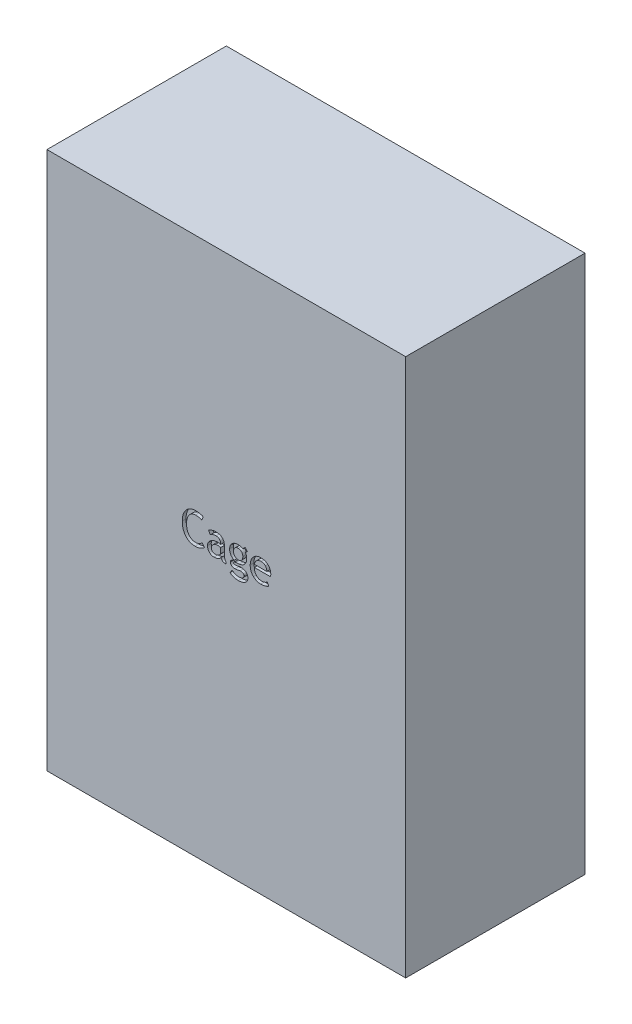
from build123d import *

# Parameters (mm, degrees)
SKETCH1_W           = 1219.2
SKETCH1_H           = 609.6
BOSS_EXTRUDE1_DEPTH = 1828.8
CUT_EXTRUDE1_DEPTH  = 12.7


with BuildPart() as part:
    # Sketch1 → Boss-Extrude1 (new body)
    with BuildSketch(Plane(origin=(0, 0, 0), x_dir=(1, 0, 0), z_dir=(0, 1, 0))):
        Rectangle(SKETCH1_W, SKETCH1_H)
    extrude(amount=BOSS_EXTRUDE1_DEPTH)

    # Sketch2 → Cut-Extrude1 (cut)
    # profile 1 of 4: a face of its own
    with BuildSketch(Plane.XY.offset(304.8)):
        with BuildLine():
            Line((-78.509090909, 1013.361038961), (-83.292207792, 1001.465097403))
            add(Edge.make_bspline(
                [(-83.292207792, 1001.465097403), (-83.897637932, 1001.787844701), (-85.160333316, 1002.460971949), (-87.266288882, 1003.239996583), (-89.588847372, 1003.948870313), (-92.170312266, 1004.495262358), (-94.986263745, 1004.921183646), (-98.055244325, 1005.226463322), (-101.364045416, 1005.411270162), (-103.654564873, 1005.432960205), (-104.836850649, 1005.444155844)],
                knots=[0, 0, 0, 0, 0.743181025, 1.549990972, 2.429353565, 3.375047818, 4.407890241, 5.516430014, 6.718068314, 8, 8, 8, 8], degree=3))
            add(Edge.make_bspline(
                [(-104.836850649, 1005.444155844), (-105.959231968, 1005.408591056), (-108.155393824, 1005.339001488), (-111.369165746, 1004.789030084), (-114.409127347, 1003.883520687), (-117.286830445, 1002.613964125), (-119.987107083, 1000.976325728), (-122.491787515, 998.942015589), (-124.852116922, 996.587966232), (-127.004966569, 993.884129839), (-128.936509189, 990.896128445), (-130.616912327, 987.673661074), (-132.083767804, 984.257898529), (-133.219834335, 980.610822602), (-134.128411469, 976.766377857), (-134.786642105, 972.709376628), (-135.183028824, 968.444835501), (-135.225239195, 965.530732972), (-135.246753247, 964.045454545)],
                knots=[0, 0, 0, 0, 0.93729464, 1.834003029, 2.715004989, 3.581291106, 4.454701967, 5.345101795, 6.270753011, 7.234680245, 8.226835646, 9.238713877, 10.267793776, 11.32822161, 12.42561983, 13.565859063, 14.75935147, 16, 16, 16, 16], degree=3))
            add(Edge.make_bspline(
                [(-135.246753247, 964.045454545), (-135.227840473, 962.628597541), (-135.190755949, 959.850397582), (-134.758646115, 955.794357834), (-134.1135294, 951.938987029), (-133.182236092, 948.290658729), (-131.989470305, 944.84918985), (-130.542779701, 941.597523866), (-128.807426387, 938.571839742), (-126.834802483, 935.761417921), (-124.636271722, 933.241680956), (-122.285175434, 931.00723765), (-119.748870134, 929.146140356), (-117.079293629, 927.601700176), (-114.243227579, 926.417774859), (-111.253289233, 925.575630887), (-108.106576538, 925.040995632), (-105.952330246, 924.984537923), (-104.857467532, 924.955844156)],
                knots=[0, 0, 0, 0, 1.226633351, 2.40520583, 3.528543623, 4.609795719, 5.6620223, 6.679728427, 7.687447284, 8.678273178, 9.648614578, 10.579204689, 11.481557175, 12.366726839, 13.244420817, 14.135573581, 15.052433801, 16, 16, 16, 16], degree=3))
            add(Edge.make_bspline(
                [(-104.857467532, 924.955844156), (-103.673774006, 924.986387262), (-101.364255298, 925.045980286), (-98.00028907, 925.543335171), (-94.857102861, 926.393079276), (-91.90638197, 927.549622507), (-89.183501521, 929.064566567), (-86.656438045, 930.890149139), (-84.366853258, 933.080326281), (-83.039835854, 934.746270601), (-82.364448052, 935.594155844)],
                knots=[0, 0, 0, 0, 1.097389961, 2.141130781, 3.144492999, 4.111406536, 5.072758937, 6.026305338, 6.995484689, 8, 8, 8, 8], degree=3))
            Line((-82.364448052, 935.594155844), (-74.550649351, 924.955844156))
            add(Edge.make_bspline(
                [(-74.550649351, 924.955844156), (-75.589438442, 924.004424936), (-77.6542195, 922.113307289), (-81.089838406, 919.703603677), (-84.734125957, 917.647026867), (-88.606881078, 915.977373223), (-92.694492639, 914.670670476), (-97.003444908, 913.751173802), (-101.529746673, 913.181939483), (-104.622105155, 913.114750277), (-106.197564935, 913.080519481)],
                knots=[0, 0, 0, 0, 0.973901451, 1.935805146, 2.896097029, 3.865214868, 4.848786196, 5.860812937, 6.910151201, 8, 8, 8, 8], degree=3))
            add(Edge.make_bspline(
                [(-106.197564935, 913.080519481), (-107.842705267, 913.12113508), (-111.058335529, 913.200523292), (-115.740074273, 913.906525015), (-120.168684223, 914.99804562), (-124.312700761, 916.606183367), (-128.202482014, 918.63199133), (-131.813968595, 921.128297435), (-135.151832207, 924.080078341), (-138.194167971, 927.461013115), (-140.903460135, 931.218480418), (-143.289189377, 935.27252547), (-145.286899371, 939.629841108), (-146.938214318, 944.257800982), (-148.219421174, 949.176598168), (-149.112615728, 954.376781264), (-149.656426696, 959.869256336), (-149.72558297, 963.624960745), (-149.761038961, 965.550487013)],
                knots=[0, 0, 0, 0, 1.026774208, 2.006957187, 2.949983192, 3.86971466, 4.775767412, 5.68286642, 6.60415852, 7.552200267, 8.517071902, 9.492319463, 10.485049057, 11.505832625, 12.557165439, 13.655005808, 14.797736077, 16, 16, 16, 16], degree=3))
            add(Edge.make_bspline(
                [(-149.761038961, 965.550487013), (-149.730538429, 967.414665576), (-149.670610156, 971.077454233), (-149.047958722, 976.438401442), (-148.092110744, 981.564443511), (-146.726045114, 986.44866179), (-144.981291766, 991.098992625), (-142.817711068, 995.498316201), (-140.277580379, 999.658025046), (-137.360483703, 1003.534764604), (-134.150832351, 1007.071095433), (-130.672166478, 1010.16881065), (-126.953673423, 1012.782581429), (-123.021949395, 1014.950477311), (-118.841742933, 1016.606949341), (-114.4332592, 1017.774348781), (-109.803728905, 1018.525321982), (-106.633464127, 1018.60067051), (-105.022402597, 1018.638961039)],
                knots=[0, 0, 0, 0, 1.151460384, 2.262420628, 3.330148846, 4.370797394, 5.392188392, 6.394959303, 7.395659951, 8.399554213, 9.388499259, 10.342092793, 11.271669333, 12.191485065, 13.110172784, 14.042422641, 15.005200576, 16, 16, 16, 16], degree=3))
            add(Edge.make_bspline(
                [(-105.022402597, 1018.638961039), (-103.647564038, 1018.623928162), (-100.971147224, 1018.594663458), (-97.07679146, 1018.345618551), (-93.408923578, 1017.936278384), (-89.97226487, 1017.367946539), (-86.762015835, 1016.6274015), (-83.790547287, 1015.725470257), (-81.040475021, 1014.66002116), (-79.340818975, 1013.787841021), (-78.509090909, 1013.361038961)],
                knots=[0, 0, 0, 0, 1.208331266, 2.352274815, 3.428237893, 4.451073276, 5.41226407, 6.321787922, 7.178765556, 8, 8, 8, 8], degree=3))
        make_face()
    # profile 2 of 4: a face of its own
    with BuildSketch(Plane.XY.offset(304.8)):
        with BuildLine():
            add(Edge.make_bspline(
                [(-17.874837662, 923.636363636), (-18.56039554, 922.790969175), (-19.921334271, 921.112730031), (-22.349532136, 918.970272111), (-25.012405503, 917.124521622), (-27.9607767, 915.64720517), (-31.164088668, 914.484420221), (-34.630432079, 913.670096435), (-38.360127835, 913.167290863), (-40.936595234, 913.110032664), (-42.26461039, 913.080519481)],
                knots=[0, 0, 0, 0, 0.944960127, 1.875892434, 2.804059133, 3.755402226, 4.734562172, 5.760675535, 6.845761903, 8, 8, 8, 8], degree=3))
            add(Edge.make_bspline(
                [(-42.26461039, 913.080519481), (-42.987527783, 913.098931277), (-44.412654183, 913.135227454), (-46.508661016, 913.465686403), (-48.547397384, 913.945246686), (-50.501367903, 914.681848663), (-52.394801298, 915.584543132), (-54.190350106, 916.718025602), (-55.940236983, 918.013506596), (-57.564696019, 919.532738767), (-59.064980714, 921.192379574), (-60.394188296, 922.96718545), (-61.507168938, 924.850090656), (-62.429853605, 926.828460625), (-63.126201247, 928.912177049), (-63.613589759, 931.089146984), (-63.941165409, 933.357676716), (-63.976658239, 934.905739025), (-63.994805195, 935.69724026)],
                knots=[0, 0, 0, 0, 0.993455545, 1.95845298, 2.911997968, 3.868815737, 4.82409202, 5.79181603, 6.784147119, 7.814064514, 8.844588789, 9.85771863, 10.857760396, 11.847207058, 12.854368548, 13.872291747, 14.912134415, 16, 16, 16, 16], degree=3))
            add(Edge.make_bspline(
                [(-63.994805195, 935.69724026), (-63.960273312, 936.647205575), (-63.892311443, 938.51682322), (-63.438947477, 941.263477775), (-62.63616001, 943.887511837), (-61.553077146, 946.408470584), (-60.1181457, 948.802853971), (-58.406957698, 951.097720435), (-56.369144219, 953.269809881), (-54.04050381, 955.294518554), (-51.493312879, 957.164221485), (-48.720874409, 958.773960211), (-45.796543293, 960.166893377), (-42.68072277, 961.266845909), (-39.419042935, 962.168383511), (-35.97408492, 962.773318152), (-32.36339107, 963.153730633), (-29.895471268, 963.198133891), (-28.636850649, 963.220779221)],
                knots=[0, 0, 0, 0, 0.914144162, 1.799118376, 2.669442492, 3.549088249, 4.432603435, 5.349184236, 6.299014847, 7.292526244, 8.315019686, 9.334664862, 10.373010545, 11.427301971, 12.510180587, 13.625743326, 14.789146875, 16, 16, 16, 16], degree=3))
            add(Edge.make_bspline(
                [(-28.636850649, 963.220779221), (-27.914623143, 963.203730344), (-26.418172038, 963.168405173), (-24.111801989, 962.905277427), (-21.661566463, 962.492013098), (-19.996453512, 962.103097433), (-19.132467532, 961.901298701)],
                knots=[0, 0, 0, 0, 0.901025355, 1.866919186, 2.893197055, 4, 4, 4, 4], degree=3))
            add(Edge.make_bspline(
                [(-19.132467532, 961.901298701), (-19.144162144, 962.595713502), (-19.166785804, 963.939084646), (-19.345770242, 965.892015391), (-19.684690213, 967.700484817), (-20.102636954, 969.39221497), (-20.688419757, 970.93218503), (-21.364767641, 972.359177683), (-22.191312952, 973.639867833), (-23.152547968, 974.782812972), (-24.226088538, 975.811115889), (-25.456518438, 976.663864963), (-26.784962629, 977.428650826), (-28.256385404, 978.007459825), (-29.838009445, 978.49829581), (-31.554842922, 978.809821101), (-33.393698664, 979.028364356), (-34.663135709, 979.045647182), (-35.316720779, 979.054545455)],
                knots=[0, 0, 0, 0, 1.232010569, 2.38337006, 3.473922505, 4.494186629, 5.47029199, 6.391873334, 7.29149648, 8.165725792, 9.03688882, 9.919916482, 10.815232808, 11.75034576, 12.71849901, 13.749128771, 14.841111628, 16, 16, 16, 16], degree=3))
            add(Edge.make_bspline(
                [(-35.316720779, 979.054545455), (-36.320911028, 979.035775608), (-38.279298624, 978.999170358), (-41.127002907, 978.685730327), (-43.798359564, 978.177889311), (-46.290592679, 977.453196163), (-48.609282838, 976.530108785), (-50.74556414, 975.389802365), (-52.710336891, 974.047096738), (-53.869867552, 972.986856482), (-54.449188312, 972.457142857)],
                knots=[0, 0, 0, 0, 1.160376748, 2.26298496, 3.306713365, 4.299604534, 5.258357027, 6.185834306, 7.093612716, 8, 8, 8, 8], degree=3))
            Line((-54.449188312, 972.457142857), (-60.036363636, 983.012987013))
            add(Edge.make_bspline(
                [(-60.036363636, 983.012987013), (-59.36040424, 983.551241085), (-57.943307692, 984.679649081), (-55.486699328, 986.119982014), (-52.692102003, 987.458160886), (-49.610303953, 988.649085549), (-46.383553402, 989.632049855), (-43.158142241, 990.393995848), (-39.995650379, 990.840672792), (-37.908878097, 990.900483766), (-36.883603896, 990.92987013)],
                knots=[0, 0, 0, 0, 0.83233406, 1.744923925, 2.737828223, 3.818310257, 4.927193929, 5.988133053, 7.011528333, 8, 8, 8, 8], degree=3))
            add(Edge.make_bspline(
                [(-36.883603896, 990.92987013), (-35.577064157, 990.906088641), (-33.048387729, 990.860061957), (-29.396080319, 990.509067041), (-26.017925658, 989.936718743), (-22.911064853, 989.14894727), (-20.087430806, 988.089788386), (-17.534931321, 986.81735598), (-15.255227369, 985.301277266), (-13.256969615, 983.526921781), (-11.502082679, 981.508047962), (-10.012713288, 979.201680846), (-8.734704833, 976.645660354), (-7.703944751, 973.807307568), (-6.907072862, 970.699483354), (-6.335505181, 967.320771617), (-6.013447257, 963.666844882), (-5.963530391, 961.145979905), (-5.937662338, 959.83961039)],
                knots=[0, 0, 0, 0, 1.2352911, 2.390781845, 3.465517746, 4.472669273, 5.416533714, 6.311624893, 7.164115709, 7.997342812, 8.831177852, 9.685499483, 10.586398193, 11.528000591, 12.535152118, 13.616293066, 14.7647089, 16, 16, 16, 16], degree=3))
            Line((-5.937662338, 959.83961039), (-5.937662338, 932.872727273))
            add(Edge.make_bspline(
                [(-5.937662338, 932.872727273), (-5.923269679, 932.08170691), (-5.89565835, 930.564188559), (-5.647711502, 928.390529498), (-5.243515052, 926.419937146), (-4.669820212, 924.652497442), (-3.928563621, 923.08676798), (-3.013334609, 921.730413377), (-1.936407496, 920.565442541), (-1.083994661, 919.972857556), (-0.65974026, 919.677922078)],
                knots=[0, 0, 0, 0, 1.279077697, 2.453822896, 3.53296146, 4.527738333, 5.452481132, 6.324974507, 7.166323045, 8, 8, 8, 8], degree=3))
            Line((-0.65974026, 919.677922078), (-0.65974026, 913.080519481))
            add(Edge.make_bspline(
                [(-0.65974026, 913.080519481), (-1.878191488, 913.099511218), (-4.160882408, 913.13509103), (-7.342842502, 913.616572081), (-10.059231404, 914.344885824), (-12.335550848, 915.431701533), (-14.203924174, 916.92115413), (-15.741984859, 918.792931156), (-16.989889211, 921.065802136), (-17.570730521, 922.753005845), (-17.874837662, 923.636363636)],
                knots=[0, 0, 0, 0, 1.322927942, 2.4784214, 3.487862418, 4.369631662, 5.198919122, 6.063344162, 6.986038252, 8, 8, 8, 8], degree=3))
        make_face()
        with BuildLine():
            add(Edge.make_bspline(
                [(-19.132467532, 952.664935065), (-20.100282372, 952.863975843), (-21.880497696, 953.230094885), (-24.321676567, 953.637315236), (-26.294036016, 953.917594636), (-27.454201967, 953.964226438), (-27.956493506, 953.984415584)],
                knots=[0, 0, 0, 0, 1.327096202, 2.441083662, 3.325070274, 4, 4, 4, 4], degree=3))
            add(Edge.make_bspline(
                [(-27.956493506, 953.984415584), (-28.781662771, 953.968594706), (-30.394636322, 953.937669343), (-32.755435175, 953.695794724), (-34.990150284, 953.24788), (-37.124205923, 952.689153687), (-39.128730136, 951.916022334), (-41.02595354, 950.987168638), (-42.790876891, 949.867452743), (-44.441160751, 948.620702948), (-45.911833815, 947.239923583), (-47.223518955, 945.802348598), (-48.320814372, 944.283010247), (-49.240178608, 942.71450051), (-49.941708215, 941.078893076), (-50.447194598, 939.385226983), (-50.736423373, 937.62457312), (-50.778646549, 936.426726419), (-50.8, 935.820941558)],
                knots=[0, 0, 0, 0, 1.220287638, 2.385318708, 3.503525747, 4.58834872, 5.643485871, 6.675260618, 7.707335663, 8.72980793, 9.729394515, 10.686538231, 11.60338903, 12.495920083, 13.370033194, 14.228646617, 15.104176635, 16, 16, 16, 16], degree=3))
            add(Edge.make_bspline(
                [(-50.8, 935.820941558), (-50.769935723, 934.861000685), (-50.713078932, 933.045585057), (-50.038132162, 930.519705818), (-48.957849825, 928.360908326), (-47.400869554, 926.59826576), (-45.404420371, 925.230451172), (-42.969191126, 924.298407439), (-40.126981589, 923.718332195), (-38.089413672, 923.664795711), (-37.007305195, 923.636363636)],
                knots=[0, 0, 0, 0, 1.090937083, 2.063152309, 2.952441297, 3.817735852, 4.712383707, 5.68197955, 6.768949218, 8, 8, 8, 8], degree=3))
            add(Edge.make_bspline(
                [(-37.007305195, 923.636363636), (-36.173194063, 923.66722146), (-34.517545622, 923.728471941), (-32.076391847, 924.248664269), (-29.711187533, 925.074696447), (-27.426056125, 926.244750781), (-25.225880514, 927.750764384), (-23.099433663, 929.583496931), (-21.025144553, 931.729742072), (-19.77648749, 933.354306211), (-19.132467532, 934.192207792)],
                knots=[0, 0, 0, 0, 0.926994493, 1.840014991, 2.763567446, 3.707150477, 4.686710869, 5.722325487, 6.825243626, 8, 8, 8, 8], degree=3))
            Line((-19.132467532, 934.192207792), (-19.132467532, 952.664935065))
        make_face(mode=Mode.SUBTRACT)
    # profile 3 of 4: a face of its own
    with BuildSketch(Plane.XY.offset(304.8)):
        with BuildLine():
            Line((12.535064935, 894.381006494), (19.64788961, 905.163636364))
            add(Edge.make_bspline(
                [(19.64788961, 905.163636364), (20.589530683, 904.534543848), (22.422283191, 903.310116707), (25.21562724, 901.694766929), (27.951810819, 900.336746366), (30.62545367, 899.206076983), (33.251340276, 898.332394407), (35.824183633, 897.716683422), (38.341980223, 897.320023834), (40.002234362, 897.27096139), (40.821428571, 897.246753247)],
                knots=[0, 0, 0, 0, 1.184445197, 2.305331583, 3.372746086, 4.378123596, 5.339779337, 6.263942773, 7.143403414, 8, 8, 8, 8], degree=3))
            add(Edge.make_bspline(
                [(40.821428571, 897.246753247), (42.233154107, 897.272987188), (44.912806167, 897.322782869), (48.686465727, 897.942313567), (52.020728496, 898.846845406), (54.428966644, 900.020182718), (56.079804438, 901.098036081), (57.124059564, 901.955487952), (58.015277302, 902.845404459), (58.777238416, 903.768118579), (59.335911808, 904.771532575), (59.726869421, 905.815486481), (59.991302191, 906.896207642), (60.021270563, 907.636121097), (60.036363636, 908.008766234)],
                knots=[0, 0, 0, 0, 2.093703985, 3.974142319, 5.663006758, 7.205436512, 7.927067427, 8.58682346, 9.207301964, 9.795302503, 10.357228975, 10.90298962, 11.447508922, 12, 12, 12, 12], degree=3))
            add(Edge.make_bspline(
                [(60.036363636, 908.008766234), (60.002091335, 908.721988104), (59.936714211, 910.082515186), (59.294906585, 911.975174927), (58.251656608, 913.591488868), (56.762554814, 914.890166233), (54.856766412, 915.852023282), (52.584234228, 916.575472733), (49.891934454, 916.961561154), (47.969734253, 917.012040745), (46.944642857, 917.038961039)],
                knots=[0, 0, 0, 0, 0.945778284, 1.804146819, 2.622921598, 3.4775355, 4.397390983, 5.44367589, 6.636736251, 8, 8, 8, 8], degree=3))
            add(Edge.make_bspline(
                [(46.944642857, 917.038961039), (46.497316128, 917.018261586), (45.446732387, 916.969647212), (43.652843063, 916.692048461), (41.404815311, 916.2806759), (38.843571793, 915.713200662), (36.213611226, 915.142402771), (33.764785446, 914.732204773), (31.639225779, 914.459837718), (30.328067869, 914.418754037), (29.729545455, 914.4)],
                knots=[0, 0, 0, 0, 0.61576396, 1.446172479, 2.49401736, 3.76065346, 5.055042787, 6.196016743, 7.176510772, 8, 8, 8, 8], degree=3))
            add(Edge.make_bspline(
                [(29.729545455, 914.4), (29.089773659, 914.402368432), (27.849119622, 914.406961328), (26.050114695, 914.600865964), (24.361674696, 914.793289925), (22.810465861, 915.163673448), (21.371614263, 915.577894573), (20.074336869, 916.145322707), (18.891643994, 916.78219334), (17.817619378, 917.510468405), (16.876346174, 918.350358572), (16.057962927, 919.292226402), (15.37253981, 920.332512042), (14.818849485, 921.471115227), (14.380424032, 922.701356055), (14.075603762, 924.029573455), (13.887038707, 925.458969984), (13.865599239, 926.446519793), (13.854545455, 926.955681818)],
                knots=[0, 0, 0, 0, 1.326766046, 2.572882493, 3.752925194, 4.84978635, 5.878503952, 6.856118156, 7.781566206, 8.663799574, 9.542683042, 10.392020665, 11.246492449, 12.120385188, 13.013618254, 13.951187018, 14.943670733, 16, 16, 16, 16], degree=3))
            add(Edge.make_bspline(
                [(13.854545455, 926.955681818), (13.894834413, 927.588582718), (13.976341468, 928.868980386), (14.770985528, 930.702088078), (15.96757431, 932.444915613), (17.641507828, 934.022017945), (19.626837236, 935.468495961), (21.875094237, 936.724754053), (24.357070574, 937.743331368), (26.10890834, 938.230472604), (27.008116883, 938.480519481)],
                knots=[0, 0, 0, 0, 0.808139807, 1.634916817, 2.52262721, 3.507708434, 4.567521049, 5.668769468, 6.803392385, 8, 8, 8, 8], degree=3))
            add(Edge.make_bspline(
                [(27.008116883, 938.480519481), (25.750464458, 939.112030635), (23.312996134, 940.33596851), (20.077315514, 942.712575429), (17.318724617, 945.397805845), (15.088489223, 948.459604279), (13.334394319, 951.835053011), (12.099283216, 955.556658432), (11.345512767, 959.609900592), (11.259803727, 962.427073593), (11.215584416, 963.880519481)],
                knots=[0, 0, 0, 0, 1.060453993, 2.055276136, 3.016126786, 3.954902892, 4.901312321, 5.875507213, 6.903924146, 8, 8, 8, 8], degree=3))
            add(Edge.make_bspline(
                [(11.215584416, 963.880519481), (11.236060269, 964.830440835), (11.276158187, 966.690674265), (11.688866049, 969.416951692), (12.320489914, 972.022310975), (13.212054658, 974.510281291), (14.354901306, 976.882957424), (15.757435761, 979.130334076), (17.42976253, 981.252771724), (19.331400015, 983.231154403), (21.416414767, 985.032869913), (23.641299355, 986.609359451), (25.974770645, 987.972569211), (28.458679325, 989.024726579), (31.041302701, 989.88614087), (33.745430235, 990.508407442), (36.579050728, 990.854075081), (38.504566959, 990.904361261), (39.481331169, 990.92987013)],
                knots=[0, 0, 0, 0, 1.042956208, 2.042423822, 3.022160224, 3.984636886, 4.940337134, 5.910365988, 6.889141792, 7.903781168, 8.920945854, 9.911906719, 10.896200396, 11.883674538, 12.86979101, 13.884514665, 14.926869414, 16, 16, 16, 16], degree=3))
            add(Edge.make_bspline(
                [(39.481331169, 990.92987013), (40.375334338, 990.92269714), (42.111504269, 990.908767068), (44.636910085, 990.666294524), (47.011944634, 990.320302392), (49.250896586, 989.858445763), (51.334731226, 989.220765737), (53.259285146, 988.427118183), (55.05421625, 987.533203927), (56.140160561, 986.798023509), (56.675811688, 986.43538961)],
                knots=[0, 0, 0, 0, 1.187598972, 2.306338158, 3.36804058, 4.376517905, 5.341416913, 6.258948422, 7.141211726, 8, 8, 8, 8], degree=3))
            Line((56.675811688, 986.43538961), (63.273214286, 994.888311688))
            Line((63.273214286, 994.888311688), (71.911688312, 986.456006494))
            Line((71.911688312, 986.456006494), (64.180357143, 980.270941558))
            add(Edge.make_bspline(
                [(64.180357143, 980.270941558), (64.591554829, 979.708705901), (65.417305342, 978.579647059), (66.43582905, 976.722141608), (67.33821191, 974.767126738), (68.027154842, 972.665747141), (68.583001299, 970.454137899), (69.005757605, 968.114034651), (69.219575691, 965.643874755), (69.254792056, 963.956456898), (69.272727273, 963.097077922)],
                knots=[0, 0, 0, 0, 0.915457603, 1.838384824, 2.781158444, 3.744642584, 4.742344353, 5.779846864, 6.869306188, 8, 8, 8, 8], degree=3))
            add(Edge.make_bspline(
                [(69.272727273, 963.097077922), (69.255059265, 962.175236047), (69.220394842, 960.366593175), (68.884928653, 957.715207937), (68.319829478, 955.186885943), (67.569158207, 952.752852081), (66.541638109, 950.454255731), (65.349420155, 948.235461636), (63.893948221, 946.162169899), (62.253711288, 944.20019416), (60.414992285, 942.424065313), (58.461486979, 940.78587174), (56.320061156, 939.426650344), (54.0807959, 938.202009194), (51.684568034, 937.221765406), (49.150508135, 936.442666671), (46.486673559, 935.823736316), (44.645400613, 935.616974862), (43.707792208, 935.511688312)],
                knots=[0, 0, 0, 0, 1.063977902, 2.087512078, 3.078957627, 4.052622123, 5.022626396, 5.981369196, 6.956422911, 7.941881261, 8.92941376, 9.904725716, 10.879682573, 11.852376671, 12.84847863, 13.862371767, 14.911482296, 16, 16, 16, 16], degree=3))
            Line((43.707792208, 935.511688312), (32.73961039, 934.542694805))
            add(Edge.make_bspline(
                [(32.73961039, 934.542694805), (32.394753551, 934.486776553), (31.634936565, 934.363572855), (30.43006876, 934.023098125), (29.064090773, 933.537796867), (27.617001306, 932.963108288), (26.254048091, 932.291154886), (25.208321949, 931.43302165), (24.541278737, 930.425453145), (24.453126913, 929.685408111), (24.41038961, 929.326623377)],
                knots=[0, 0, 0, 0, 0.798572579, 1.759480869, 2.858113958, 4.113260822, 5.322692235, 6.314972957, 7.183074066, 8, 8, 8, 8], degree=3))
            add(Edge.make_bspline(
                [(24.41038961, 929.326623377), (24.426740506, 929.081573729), (24.458815488, 928.600868357), (24.823625524, 927.94947085), (25.39237686, 927.423393218), (26.153457139, 926.989124287), (27.128628619, 926.671218038), (28.303561729, 926.429177667), (29.698800071, 926.289985064), (30.6982239, 926.28044466), (31.234577922, 926.275324675)],
                knots=[0, 0, 0, 0, 0.708089236, 1.389034028, 2.111423877, 2.946128647, 3.921545664, 5.088153572, 6.437319086, 8, 8, 8, 8], degree=3))
            add(Edge.make_bspline(
                [(31.234577922, 926.275324675), (31.805573195, 926.294842882), (33.089118715, 926.338718038), (35.213924164, 926.613310176), (37.751118637, 927.025156018), (40.5597288, 927.597673245), (43.370007106, 928.161457395), (45.920078649, 928.57861199), (48.059015432, 928.850868925), (49.356237662, 928.894742182), (49.934090909, 928.914285714)],
                knots=[0, 0, 0, 0, 0.724765678, 1.629207425, 2.716102254, 3.987031745, 5.266521789, 6.353416617, 7.266522319, 8, 8, 8, 8], degree=3))
            add(Edge.make_bspline(
                [(49.934090909, 928.914285714), (50.827966589, 928.898789226), (52.564359663, 928.868686612), (55.096279318, 928.626075518), (57.463092238, 928.184640827), (59.69312632, 927.622951834), (61.754688898, 926.845643283), (63.693839371, 925.947439262), (65.469226983, 924.850494754), (67.083245949, 923.587608374), (68.527117525, 922.18427306), (69.804526781, 920.654486144), (70.847324103, 918.971700825), (71.728260216, 917.179841934), (72.413760141, 915.251321909), (72.872447553, 913.187026139), (73.173073944, 911.000087761), (73.211441247, 909.501101439), (73.231168831, 908.730357143)],
                knots=[0, 0, 0, 0, 1.228476805, 2.386370572, 3.490547913, 4.535231113, 5.542346557, 6.514116706, 7.468284222, 8.403564812, 9.325345948, 10.23116451, 11.135257843, 12.039252491, 12.971332102, 13.940528263, 14.941066992, 16, 16, 16, 16], degree=3))
            add(Edge.make_bspline(
                [(73.231168831, 908.730357143), (73.20468531, 907.876234592), (73.152644431, 906.197859266), (72.704675991, 903.746099053), (71.989148297, 901.420898365), (70.956409825, 899.230263171), (69.659156925, 897.157507104), (68.039734976, 895.229205018), (66.163416042, 893.405826428), (63.99591698, 891.758489849), (61.63507434, 890.251977117), (59.081803614, 888.955237327), (56.386513782, 887.844872543), (53.534200746, 886.927166271), (50.532616893, 886.236000699), (47.376383665, 885.747647471), (44.071792294, 885.425821549), (41.811819731, 885.389828611), (40.656493506, 885.371428571)],
                knots=[0, 0, 0, 0, 0.916604991, 1.801155113, 2.667160974, 3.522312259, 4.394584979, 5.285668894, 6.21993082, 7.198638882, 8.203922042, 9.223836096, 10.269564828, 11.331522603, 12.437867392, 13.573559167, 14.759573115, 16, 16, 16, 16], degree=3))
            add(Edge.make_bspline(
                [(40.656493506, 885.371428571), (39.431474853, 885.403373466), (36.944339637, 885.468230659), (33.1702821, 886.003523426), (29.290492413, 886.789499269), (25.415941099, 887.946281251), (21.672740814, 889.285369259), (18.265953168, 890.837042949), (15.198399192, 892.462125842), (13.402098535, 893.756325609), (12.535064935, 894.381006494)],
                knots=[0, 0, 0, 0, 0.980661874, 1.991021668, 3.047761857, 4.148517958, 5.226261617, 6.228811154, 7.145087302, 8, 8, 8, 8], degree=3))
        make_face()
        with BuildLine():
            add(Edge.make_bspline(
                [(40.574025974, 980.374025974), (39.989067308, 980.357765011), (38.848993588, 980.326072692), (37.179024374, 980.090309628), (35.590141101, 979.723223659), (34.073070891, 979.208127715), (32.641491421, 978.531617495), (31.322366475, 977.662230693), (30.046318913, 976.699977076), (28.888993536, 975.568547348), (27.839776862, 974.339496791), (26.932895119, 973.028283427), (26.134692893, 971.674213334), (25.525766332, 970.232733394), (25.014928128, 968.741407367), (24.683452637, 967.176050732), (24.431357697, 965.551681041), (24.417473448, 964.445103048), (24.41038961, 963.880519481)],
                knots=[0, 0, 0, 0, 1.087134974, 2.118806143, 3.129055095, 4.11485463, 5.092006634, 6.063042738, 7.046853435, 8.058797368, 9.064836931, 10.046571638, 11.019538817, 11.980776464, 12.950382779, 13.945328976, 14.951692963, 16, 16, 16, 16], degree=3))
            add(Edge.make_bspline(
                [(24.41038961, 963.880519481), (24.420748394, 963.254622843), (24.44118346, 962.019898867), (24.647511635, 960.211664891), (25.005847523, 958.483613309), (25.474713525, 956.841118612), (26.067346716, 955.270520485), (26.849203296, 953.80761087), (27.724619856, 952.405431796), (28.735456377, 951.102215287), (29.869833368, 949.928645783), (31.106519249, 948.886737354), (32.459425462, 948.025687809), (33.888953042, 947.289715019), (35.427516379, 946.733692503), (37.059876441, 946.34510311), (38.787682418, 946.11708491), (39.968577636, 946.084327358), (40.574025974, 946.067532468)],
                knots=[0, 0, 0, 0, 1.110163763, 2.190051414, 3.223078025, 4.238028995, 5.21848392, 6.194683906, 7.175669401, 8.148818754, 9.114607275, 10.066909283, 11.010507124, 11.953868604, 12.914331683, 13.905043954, 14.925910075, 16, 16, 16, 16], degree=3))
            add(Edge.make_bspline(
                [(40.574025974, 946.067532468), (41.165898541, 946.083755096), (42.319741897, 946.115380775), (43.996236122, 946.349954126), (45.587325716, 946.708044045), (47.058076788, 947.275134756), (48.448967808, 947.957381468), (49.724801627, 948.809017931), (50.916061744, 949.803601748), (51.979322257, 950.96644905), (52.948481876, 952.241518299), (53.794688713, 953.621354236), (54.499103141, 955.102418619), (55.077655197, 956.67621457), (55.525517684, 958.346925801), (55.862040297, 960.109825232), (56.042286013, 961.966202122), (56.065889909, 963.234168948), (56.077922078, 963.880519481)],
                knots=[0, 0, 0, 0, 1.065438539, 2.077050447, 3.043603316, 3.995225672, 4.908412501, 5.828283312, 6.750482071, 7.696211972, 8.659034036, 9.631116881, 10.605324328, 11.607658684, 12.646385146, 13.716771403, 14.836116221, 16, 16, 16, 16], degree=3))
            add(Edge.make_bspline(
                [(56.077922078, 963.880519481), (56.068397715, 964.444769456), (56.049745547, 965.549776223), (55.832575771, 967.17798142), (55.491714126, 968.740911854), (54.985189478, 970.233684937), (54.369720986, 971.667777868), (53.601310043, 973.034950831), (52.688009496, 974.332893583), (51.663377652, 975.562465218), (50.546402263, 976.698955868), (49.311113679, 977.661925086), (48.037683493, 978.525683837), (46.669672648, 979.20410147), (45.235400827, 979.720097068), (43.743314603, 980.090767791), (42.182600441, 980.325121998), (41.117776294, 980.357494845), (40.574025974, 980.374025974)],
                knots=[0, 0, 0, 0, 1.072473089, 2.100292551, 3.118174703, 4.110132825, 5.093529361, 6.08246913, 7.086835234, 8.107650165, 9.124272821, 10.110184995, 11.081697148, 12.046150082, 13.005363556, 13.975379923, 14.966131808, 16, 16, 16, 16], degree=3))
        make_face(mode=Mode.SUBTRACT)
    # profile 4 of 4: a face of its own
    with BuildSketch(Plane.XY.offset(304.8)):
        with BuildLine():
            Line((150.029058442, 951.345454545), (95.662337662, 951.345454545))
            add(Edge.make_bspline(
                [(95.662337662, 951.345454545), (95.688618285, 950.22454726), (95.739684955, 948.046478532), (96.061479465, 944.879001529), (96.636778651, 941.918712387), (97.448337221, 939.162197663), (98.449775461, 936.581343299), (99.709166266, 934.209226442), (101.200664829, 932.031626912), (102.374558358, 930.750009988), (102.960714286, 930.110064935)],
                knots=[0, 0, 0, 0, 1.167775368, 2.269139511, 3.312377417, 4.304673693, 5.259241788, 6.191231847, 7.096834467, 8, 8, 8, 8], degree=3))
            add(Edge.make_bspline(
                [(102.960714286, 930.110064935), (103.50500396, 929.586802308), (104.582181992, 928.551237914), (106.405277144, 927.264701835), (108.30448668, 926.129141989), (110.339544617, 925.2345228), (112.470706507, 924.490879069), (114.730751458, 924.01875108), (117.094242797, 923.689633601), (118.71080056, 923.654376325), (119.536688312, 923.636363636)],
                knots=[0, 0, 0, 0, 0.989843858, 1.958953311, 2.921404456, 3.890597899, 4.872059572, 5.879024385, 6.91640879, 8, 8, 8, 8], degree=3))
            add(Edge.make_bspline(
                [(119.536688312, 923.636363636), (120.479093447, 923.655222554), (122.327915223, 923.692220207), (125.044414152, 924.01137564), (127.645720655, 924.520404144), (130.130476085, 925.243287129), (132.492295855, 926.172695244), (134.72798977, 927.312926904), (136.850995915, 928.655972264), (138.156344116, 929.705446655), (138.813474026, 930.233766234)],
                knots=[0, 0, 0, 0, 1.086166282, 2.13085413, 3.148605832, 4.138974104, 5.110011886, 6.070258581, 7.028542114, 8, 8, 8, 8], degree=3))
            Line((138.813474026, 930.233766234), (144.483116883, 920.997402597))
            add(Edge.make_bspline(
                [(144.483116883, 920.997402597), (143.905191668, 920.504973695), (142.673754104, 919.455710863), (140.421152774, 918.176127521), (137.805673429, 916.921573833), (135.873580756, 916.255938078), (134.855032468, 915.905032468)],
                knots=[0, 0, 0, 0, 0.829008863, 1.766444218, 2.822528312, 4, 4, 4, 4], degree=3))
            add(Edge.make_bspline(
                [(134.855032468, 915.905032468), (133.473921821, 915.466132269), (130.662185247, 914.572596517), (126.231954104, 913.712109864), (121.576649418, 913.191444303), (118.397323538, 913.118012321), (116.774025974, 913.080519481)],
                knots=[0, 0, 0, 0, 0.945414737, 1.92472428, 2.940407449, 4, 4, 4, 4], degree=3))
            add(Edge.make_bspline(
                [(116.774025974, 913.080519481), (115.597393815, 913.106054434), (113.276325805, 913.156425626), (109.865005548, 913.621153041), (106.593679588, 914.383974075), (103.461079917, 915.444543486), (100.455264555, 916.780972404), (97.5963661, 918.45118356), (94.860845872, 920.403717275), (93.187758211, 921.92160728), (92.343019481, 922.687987013)],
                knots=[0, 0, 0, 0, 1.048227686, 2.067772609, 3.061680434, 4.037860413, 5.011115386, 5.988102045, 6.984196606, 8, 8, 8, 8], degree=3))
            add(Edge.make_bspline(
                [(92.343019481, 922.687987013), (91.449751074, 923.590457343), (89.672950841, 925.385561122), (87.380849526, 928.395168977), (85.449412592, 931.634786481), (83.884189092, 935.104630616), (82.630324805, 938.787321485), (81.788722626, 942.711279577), (81.224620627, 946.848299749), (81.173962138, 949.68725252), (81.148051948, 951.139285714)],
                knots=[0, 0, 0, 0, 0.967481273, 1.924417048, 2.876158889, 3.837660968, 4.822011602, 5.836599495, 6.893490101, 8, 8, 8, 8], degree=3))
            add(Edge.make_bspline(
                [(81.148051948, 951.139285714), (81.183890252, 952.645928951), (81.254164976, 955.600280172), (81.79823785, 959.913364676), (82.681464426, 964.000184853), (83.914729408, 967.861127487), (85.53393551, 971.486374078), (87.498762012, 974.881511191), (89.819424842, 978.059039826), (91.633379079, 979.953573596), (92.549188312, 980.910064935)],
                knots=[0, 0, 0, 0, 1.103286409, 2.163415646, 3.178379871, 4.162134233, 5.126549343, 6.08055717, 7.030932849, 8, 8, 8, 8], degree=3))
            add(Edge.make_bspline(
                [(92.549188312, 980.910064935), (93.40823214, 981.709360318), (95.097826958, 983.281439986), (97.833941664, 985.335485589), (100.702616362, 987.050878626), (103.669654075, 988.487309942), (106.769203594, 989.582101992), (109.978645336, 990.373014767), (113.311215219, 990.826046164), (115.570054159, 990.895003638), (116.712175325, 990.92987013)],
                knots=[0, 0, 0, 0, 1.047961233, 2.061163597, 3.050032296, 4.030553054, 5.001664552, 5.981646773, 6.979473968, 8, 8, 8, 8], degree=3))
            add(Edge.make_bspline(
                [(116.712175325, 990.92987013), (118.025806544, 990.901414491), (120.591028772, 990.845847116), (124.330667235, 990.435248135), (127.854475861, 989.732419956), (131.162392456, 988.767852662), (134.258730311, 987.534813017), (137.122629015, 985.992230041), (139.783787198, 984.187309474), (141.36484121, 982.757250813), (142.153409091, 982.043993506)],
                knots=[0, 0, 0, 0, 1.140665541, 2.227459699, 3.262123076, 4.257359294, 5.215990926, 6.15052194, 7.077552707, 8, 8, 8, 8], degree=3))
            add(Edge.make_bspline(
                [(142.153409091, 982.043993506), (142.86402115, 981.316362412), (144.274355587, 979.872250711), (146.093227035, 977.453003131), (147.653159222, 974.867649209), (148.911663977, 972.0908205), (149.877725083, 969.143324924), (150.583956437, 966.031778583), (150.995795702, 962.74390623), (151.051884553, 960.493632774), (151.080519481, 959.344805195)],
                knots=[0, 0, 0, 0, 0.971813225, 1.928734025, 2.886782605, 3.854408881, 4.837446585, 5.848277975, 6.901485685, 8, 8, 8, 8], degree=3))
            add(Edge.make_bspline(
                [(151.080519481, 959.344805195), (151.071162558, 958.636337988), (151.052770157, 957.243741905), (150.833033917, 955.199403196), (150.515982144, 953.233512021), (150.189811627, 951.968778592), (150.029058442, 951.345454545)],
                knots=[0, 0, 0, 0, 1.050108016, 2.064141145, 3.045911693, 4, 4, 4, 4], degree=3))
        make_face()
        with BuildLine():
            add(Edge.make_bspline(
                [(117.454383117, 980.374025974), (116.711023353, 980.362795571), (115.252689976, 980.340763612), (113.12311403, 980.031638637), (111.084304119, 979.586638661), (109.136764922, 978.942661698), (107.271815808, 978.114381385), (105.495672569, 977.101636693), (103.810130652, 975.905918751), (102.793136216, 974.970075896), (102.280357143, 974.498214286)],
                knots=[0, 0, 0, 0, 1.06759705, 2.094426531, 3.086601989, 4.06436251, 5.037270591, 6.015031111, 6.999158234, 8, 8, 8, 8], degree=3))
            add(Edge.make_bspline(
                [(102.280357143, 974.498214286), (101.81007531, 974.026007397), (100.880458181, 973.092584965), (99.667628614, 971.547736958), (98.579086919, 969.938754274), (97.680199629, 968.226149344), (96.928449276, 966.43232381), (96.335607227, 964.562959906), (95.888621616, 962.604909909), (95.738665814, 961.264230033), (95.662337662, 960.581818182)],
                knots=[0, 0, 0, 0, 1.014452497, 2.005292046, 2.986739539, 3.97025095, 4.946323062, 5.946247264, 6.954630981, 8, 8, 8, 8], degree=3))
            Line((95.662337662, 960.581818182), (137.885714286, 960.581818182))
            add(Edge.make_bspline(
                [(137.885714286, 960.581818182), (137.870813998, 961.256148311), (137.841517595, 962.581991607), (137.58349926, 964.519086204), (137.194349015, 966.37647376), (136.643515941, 968.147834241), (135.907804622, 969.835307019), (135.028247496, 971.443769365), (133.968700775, 972.957867847), (133.159279084, 973.88667311), (132.75211039, 974.353896104)],
                knots=[0, 0, 0, 0, 1.074154994, 2.111964356, 3.108624356, 4.095792429, 5.062147245, 6.037581814, 7.012831928, 8, 8, 8, 8], degree=3))
            add(Edge.make_bspline(
                [(132.75211039, 974.353896104), (132.273364008, 974.831113596), (131.319251491, 975.782179127), (129.725024674, 977.030918939), (127.98239317, 978.052896996), (126.12852409, 978.914731808), (124.141234639, 979.566708908), (122.023594501, 980.049052565), (119.776618334, 980.305410304), (118.238394485, 980.350860592), (117.454383117, 980.374025974)],
                knots=[0, 0, 0, 0, 0.95760174, 1.908442216, 2.860628821, 3.81510446, 4.800779991, 5.819262726, 6.888508446, 8, 8, 8, 8], degree=3))
        make_face(mode=Mode.SUBTRACT)
    extrude(amount=-CUT_EXTRUDE1_DEPTH, mode=Mode.SUBTRACT)


solid = part.part
